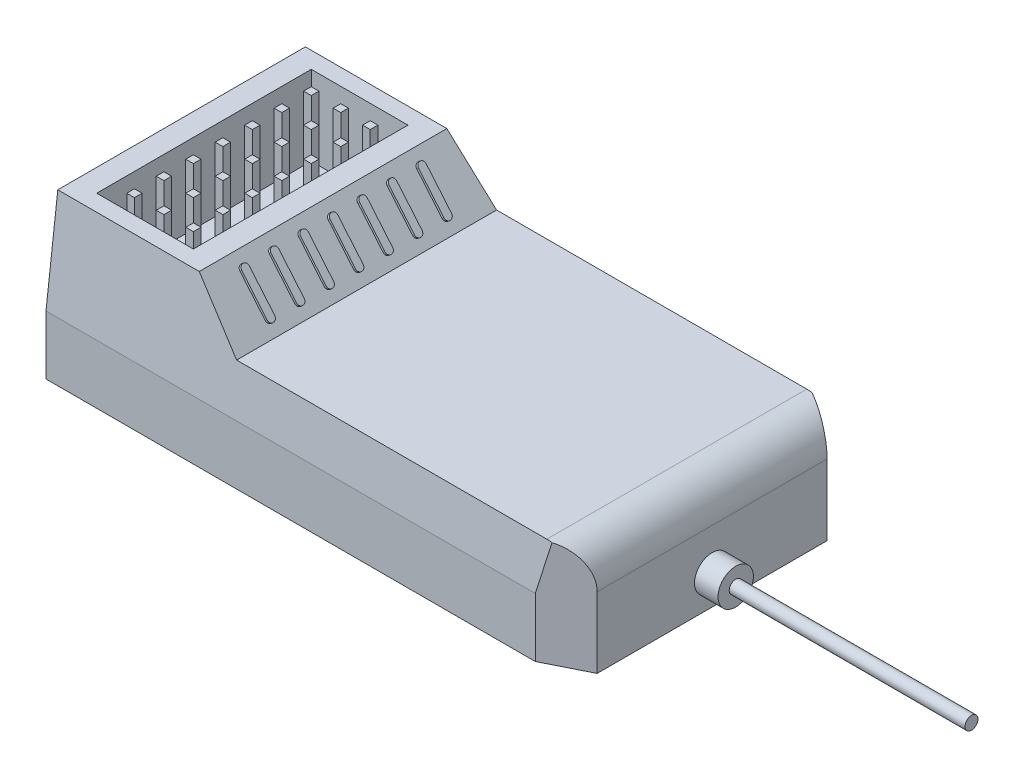
from build123d import *

# Parameters (mm, degrees)
ESQUISSE1_W                     = 45
ESQUISSE1_H                     = 23
EXTRUSION1_DEPTH                = 13.4
ENL_V_MAT_EXTRU_1_DEPTH         = 29.601748198
ENL_V_MAT_EXTRU_1_DEPTH_BACK    = 29.601748198
ENL_V_MAT_EXTRU_2_DEPTH         = 29.601748198
ENL_V_MAT_EXTRU_2_DEPTH_BACK    = 29.601748198
CONG_1_R                        = 3
ENL_V_MAT_EXTRU_3_DEPTH         = 29.601748198
ENL_V_MAT_EXTRU_3_DEPTH_BACK    = 29.601748198
ESQUISSE5_W                     = 8.2
ESQUISSE5_H                     = 18.2
ENL_V_MAT_EXTRU_4_DEPTH         = 6.75
ESQUISSE6_R                     = 1.5
EXTRUSION2_DEPTH                = 2
ESQUISSE7_R                     = 0.55
EXTRUSION3_DEPTH                = 20
EXTRUSION4_REACH                = 49.875
ESQUISSE8_W                     = 0.65
ESQUISSE8_H                     = 0.65
R_P_TITION_LIN_AIRE1_COUNT      = 3
R_P_TITION_LIN_AIRE1_PITCH      = 2.5
R_P_TITION_LIN_AIRE1_COUNT_DIR2 = 7
R_P_TITION_LIN_AIRE1_PITCH_DIR2 = 2.5
EXTRUSION5_DEPTH                = 0.2
R_P_TITION_LIN_AIRE2_COUNT      = 7
R_P_TITION_LIN_AIRE2_PITCH      = 2.5


with BuildPart() as part:
    # Esquisse1 → Extrusion1 (new body)
    with BuildSketch(Plane(origin=(0, 0, 0), x_dir=(1, 0, 0), z_dir=(0, 1, 0))):
        Rectangle(ESQUISSE1_W, ESQUISSE1_H)
    extrude(amount=EXTRUSION1_DEPTH)

    # Esquisse2 → Enlèv. mat.-Extru.1 (cut, two sides: drawn at the far end of the back side and taken through both)
    with BuildSketch(Plane.XY.offset(-ENL_V_MAT_EXTRU_1_DEPTH_BACK)):
        Polygon((22.5, 13.4), (22.5, 9), (-6.807961623, 9), (-10.5, 13.4), align=None)
    extrude(amount=ENL_V_MAT_EXTRU_1_DEPTH + ENL_V_MAT_EXTRU_1_DEPTH_BACK, mode=Mode.SUBTRACT)

    # Esquisse3 → Enlèv. mat.-Extru.2 (cut, two sides: drawn at the far end of the back side and taken through both)
    with BuildSketch(Plane(origin=(0, 0, 0), x_dir=(0, 0, -1), z_dir=(1, 0, 0)).offset(-ENL_V_MAT_EXTRU_2_DEPTH_BACK)):
        Polygon((18.471230279, -53.558334344), (11.5, 5), (10.5, 13.4), (-10.5, 13.4), (-11.5, 5), (-18.471230279, -53.558334344), (-18.471230279, 64.385322929), (18.471230279, 64.385322929), align=None)
    extrude(amount=ENL_V_MAT_EXTRU_2_DEPTH + ENL_V_MAT_EXTRU_2_DEPTH_BACK, mode=Mode.SUBTRACT)

    # Congé1
    cong_1_edges = [part.edges().sort_by_distance(p)[0] for p in [
        (22.5, 9, 0),
    ]]
    fillet(cong_1_edges, radius=CONG_1_R)

    # Esquisse4 → Enlèv. mat.-Extru.3 (cut, two sides: drawn at the far end of the back side and taken through both)
    with BuildSketch(Plane(origin=(0, 0, 0), x_dir=(1, 0, 0), z_dir=(0, 1, 0)).offset(-ENL_V_MAT_EXTRU_3_DEPTH_BACK)):
        Polygon((133.574230148, 11.5), (22.5, 11.5), (19, 11.5), (42, 0), (19, -11.5), (22.5, -11.5), (133.574230148, -11.5), (355.722690444, -11.5), (355.722690444, 11.5), align=None)
    extrude(amount=ENL_V_MAT_EXTRU_3_DEPTH + ENL_V_MAT_EXTRU_3_DEPTH_BACK, mode=Mode.SUBTRACT)

    # Esquisse5 → Enlèv. mat.-Extru.4 (cut)
    with BuildSketch(Plane(origin=(0, 13.4, 0), x_dir=(-1, 0, 0), z_dir=(0, 1, 0))):
        with Locations((16.5, 0)):
            Rectangle(ESQUISSE5_W, ESQUISSE5_H)
    extrude(amount=-ENL_V_MAT_EXTRU_4_DEPTH, mode=Mode.SUBTRACT)

    # Esquisse6 → Extrusion2 (add)
    with BuildSketch(Plane(origin=(22.5, 0, 0), x_dir=(0, 0, -1), z_dir=(1, 0, 0))):
        with Locations(Location((0, 2.5, 0), (0, 0, 180))):
            Circle(ESQUISSE6_R)
    extrude(amount=EXTRUSION2_DEPTH)

    # Esquisse7 → Extrusion3 (add)
    with BuildSketch(Plane(origin=(24.5, 0, 0), x_dir=(0, 0, -1), z_dir=(1, 0, 0))):
        with Locations((0, 2.5)):
            Circle(ESQUISSE7_R)
    extrude(amount=EXTRUSION3_DEPTH)

    # Esquisse8 → Extrusion4 (add, up to next)
    with BuildSketch(Plane(origin=(0, 13.4, 0), x_dir=(-1, 0, 0), z_dir=(0, 1, 0)), mode=Mode.PRIVATE) as extrusion4_sk1:
        with Locations((14, -7.5)):
            Rectangle(ESQUISSE8_W, ESQUISSE8_H)
    extrusion4_tool1 = extrude(extrusion4_sk1.sketch, amount=-EXTRUSION4_REACH, mode=Mode.PRIVATE) - part.part
    extrusion4 = extrusion4_tool1.solids().sort_by_distance((-14, 13.4, -7.5))[0]
    add(extrusion4)

    # Répétition linéaire1: Extrusion4 3 × 7
    with Locations(*[(-i * R_P_TITION_LIN_AIRE1_PITCH, 0, j * R_P_TITION_LIN_AIRE1_PITCH_DIR2) for i in range(R_P_TITION_LIN_AIRE1_COUNT) for j in range(R_P_TITION_LIN_AIRE1_COUNT_DIR2) if (i, j) != (0, 0)]):
        add(extrusion4)

    # Esquisse9 → Extrusion5 (add)
    with BuildSketch(Plane(origin=(0.436559012, 0.366316506, 0), x_dir=(0, 0, -1), z_dir=(0.766044443118982, 0.6427876096865347, 0))):
        with BuildLine():
            Line((7.175, 12.467369403), (7.175, 15.817369403))
            ThreePointArc((7.175, 15.817369403), (7.5, 16.142369403), (7.825, 15.817369403))
            Line((7.825, 15.817369403), (7.825, 12.467369403))
            ThreePointArc((7.825, 12.467369403), (7.5, 12.142369403), (7.175, 12.467369403))
        make_face()
    extrusion5 = extrude(amount=EXTRUSION5_DEPTH)

    # Répétition linéaire2: Extrusion5 ×7
    with Locations(*[(0, 0, i * R_P_TITION_LIN_AIRE2_PITCH) for i in range(1, R_P_TITION_LIN_AIRE2_COUNT)]):
        add(extrusion5)


solid = part.part
